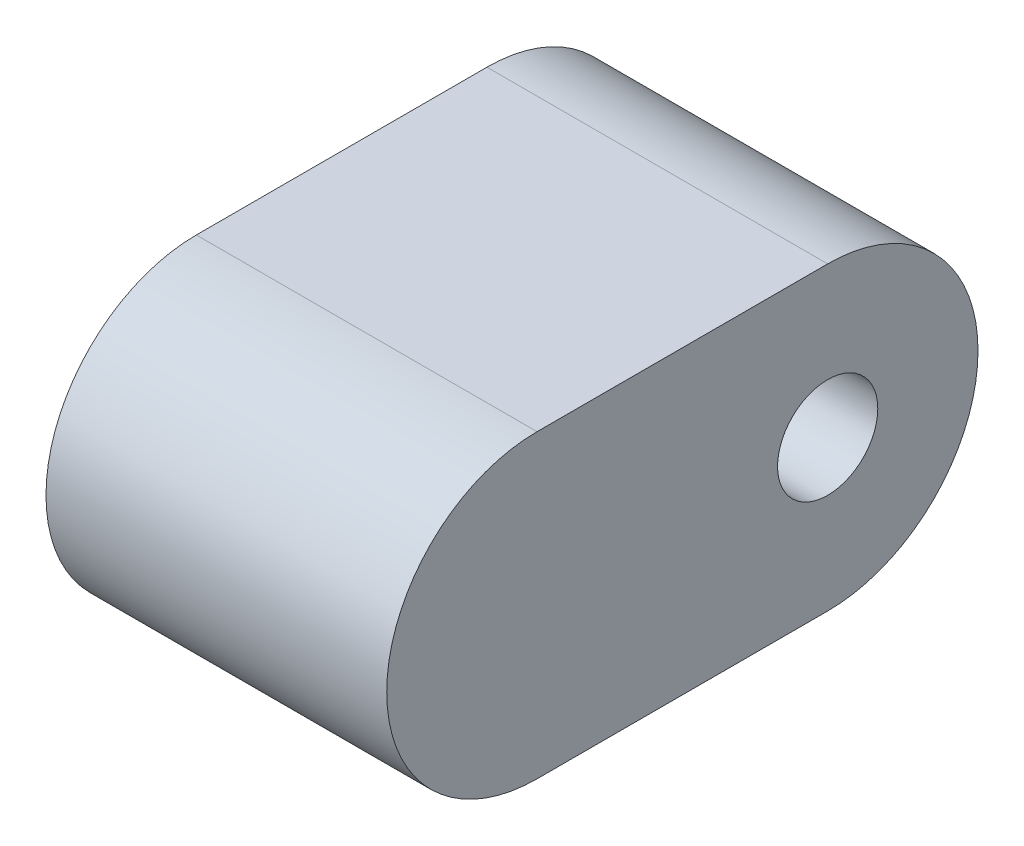
from build123d import *

# Parameters (mm, degrees)
CROQUIS1_R              = 2.5
SALIENTE_EXTRUIR1_DEPTH = 8.5


with BuildPart() as part:
    # Croquis1 → Saliente-Extruir1 (new, symmetric)
    with BuildSketch(Plane(origin=(0, 0, 0), x_dir=(0, 0, -1), z_dir=(1, 0, 0))):
        with BuildLine():
            Line((0, 7.5), (-14.5, 7.5))
            ThreePointArc((-14.5, 7.5), (-22, 0), (-14.5, -7.5))
            Line((-14.5, -7.5), (0, -7.5))
            ThreePointArc((0, -7.5), (7.5, 0), (0, 7.5))
        make_face()
        Circle(CROQUIS1_R, mode=Mode.SUBTRACT)
    extrude(amount=SALIENTE_EXTRUIR1_DEPTH, both=True)


solid = part.part
